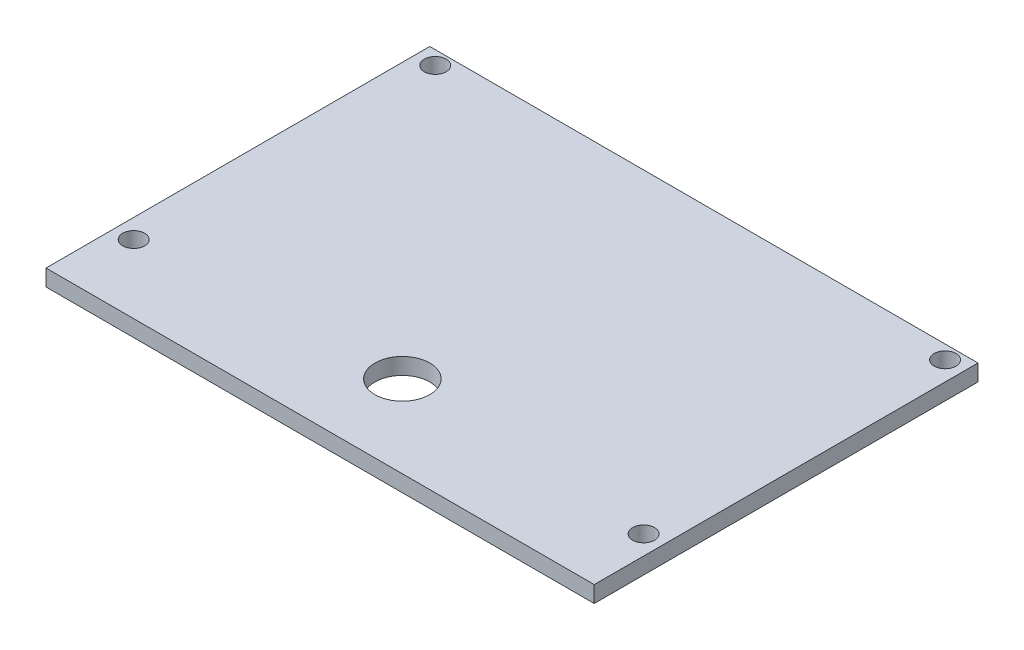
from build123d import *

# Parameters (mm, degrees)
SKETCH1_W           = 100
SKETCH1_H           = 70
SKETCH1_R           = 2
SKETCH1_R_2         = 5
BOSS_EXTRUDE1_DEPTH = 3


with BuildPart() as part:
    # Sketch1 → Boss-Extrude1 (new body)
    with BuildSketch(Plane(origin=(0, 0, 0), x_dir=(1, 0, 0), z_dir=(0, 1, 0))):
        with Locations((35.554909051, -27.950310559)):
            Rectangle(SKETCH1_W, SKETCH1_H)
        with Locations(Location((-10.945090949, 4.549689441, 0), (0, 0, 270))):
            Circle(SKETCH1_R, mode=Mode.SUBTRACT)
        with Locations(Location((82.054909051, 4.549689441, 0), (0, 0, 270))):
            Circle(SKETCH1_R, mode=Mode.SUBTRACT)
        with Locations(Location((-10.945090949, -50.450310559, 0), (0, 0, 270))):
            Circle(SKETCH1_R, mode=Mode.SUBTRACT)
        with Locations(Location((82.054909051, -50.450310559, 0), (0, 0, 270))):
            Circle(SKETCH1_R, mode=Mode.SUBTRACT)
        with Locations(Location((35.554909051, -47.950310559, 0), (0, 0, 270))):
            Circle(SKETCH1_R_2, mode=Mode.SUBTRACT)
    extrude(amount=BOSS_EXTRUDE1_DEPTH)


solid = part.part
